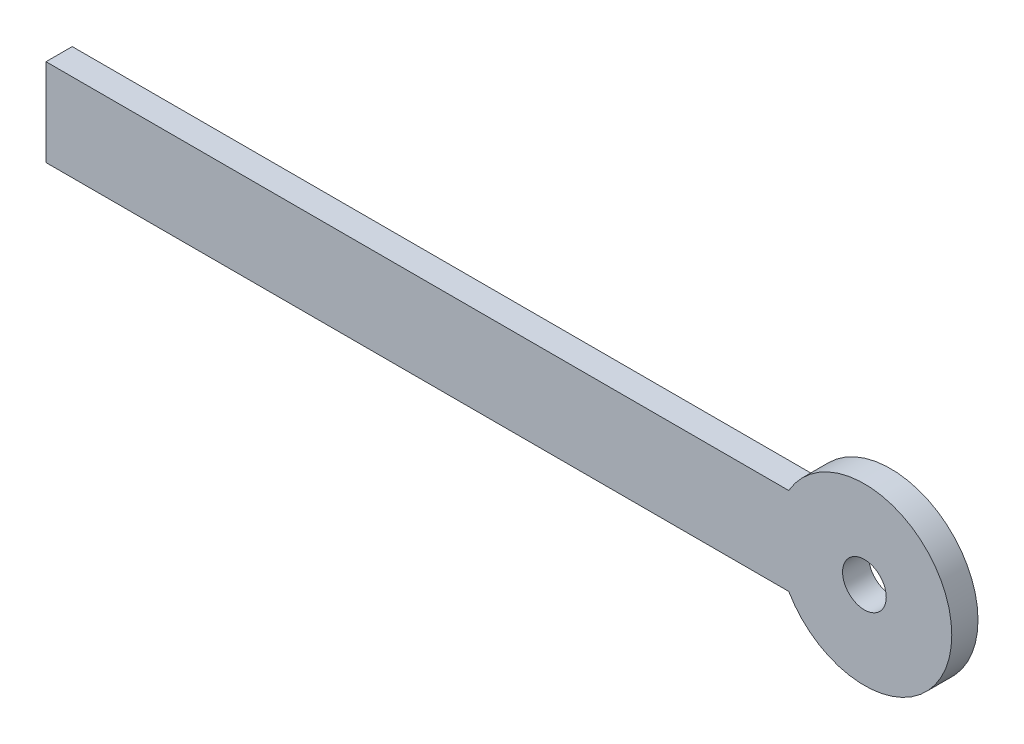
from build123d import *

# Parameters (mm, degrees)
SKETCH1_R           = 2.5
BOSS_EXTRUDE1_DEPTH = 3


with BuildPart() as part:
    # Sketch1 → Boss-Extrude1 (new body)
    with BuildSketch(Plane.XY):
        with BuildLine():
            Line((-93.660254038, 5), (-8.660254038, 5))
            ThreePointArc((-8.660254038, 5), (10, 0), (-8.660254038, -5))
            Line((-8.660254038, -5), (-93.660254038, -5))
            Line((-93.660254038, -5), (-93.660254038, 5))
        make_face()
        Circle(SKETCH1_R, mode=Mode.SUBTRACT)
    extrude(amount=BOSS_EXTRUDE1_DEPTH)


solid = part.part
